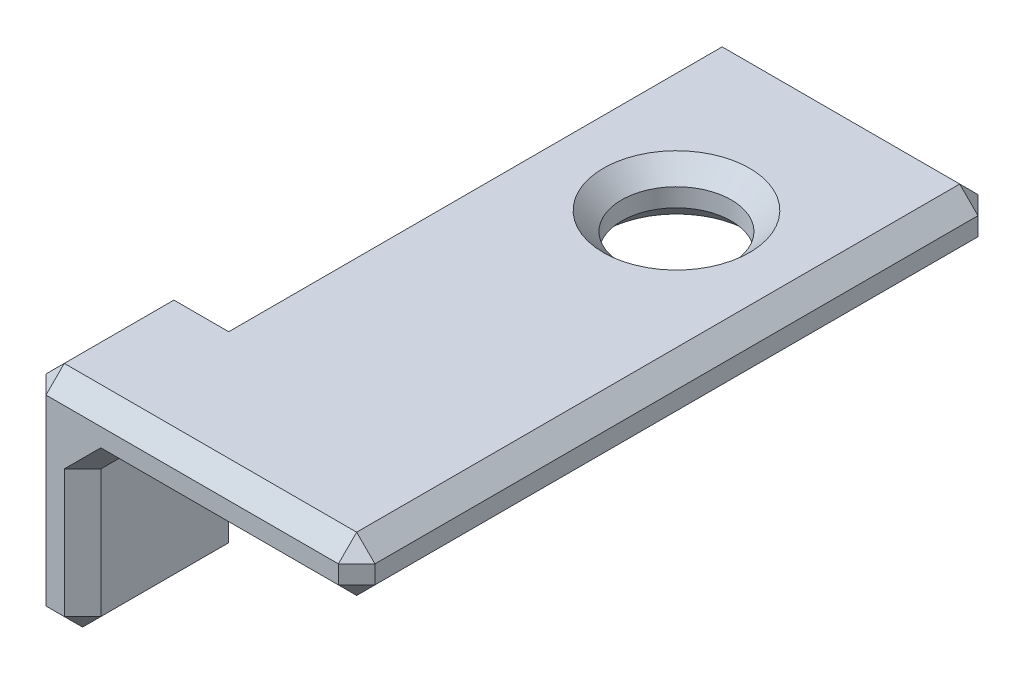
from build123d import *

# Parameters (mm, degrees)
SKETCH_1_W           = 15
SKETCH_1_H           = 20
SKETCH_1_R           = 3
EXTRUDE_1_DEPTH      = 3
SKETCH_2_W           = 15
SKETCH_2_H           = 15
EXTRUDE_2_DEPTH      = 3
EXTRUDE_3_DEPTH      = 9
EXTRUDE_3_DEPTH_BACK = 3
SKETCH_4_W           = 3
SKETCH_4_H           = 8
CHAMFER_1_SIZE       = 1


with BuildPart() as part:
    # 草图1 → 凸台-拉伸1 (new body)
    with BuildSketch(Plane(origin=(0, 0, 0), x_dir=(1, 0, 0), z_dir=(0, 1, 0))):
        with Locations((7.5, -10)):
            Rectangle(SKETCH_1_W, SKETCH_1_H)
        with Locations(Location((7.5, -10, 0), (0, 0, 270))):
            Circle(SKETCH_1_R, mode=Mode.SUBTRACT)
    extrude(amount=EXTRUDE_1_DEPTH)

    # 草图2 → 凸台-拉伸2 (add)
    with BuildSketch(Plane(origin=(0, 3, 0), x_dir=(1, 0, 0), z_dir=(0, 1, 0))):
        with Locations((7.5, -27.5)):
            Rectangle(SKETCH_2_W, SKETCH_2_H)
    extrude(amount=-EXTRUDE_2_DEPTH)

    # 草图4 → 凸台-拉伸3 (add, two sides: drawn at the far end of the back side and taken through both)
    with BuildSketch(Plane.XZ.offset(-EXTRUDE_3_DEPTH_BACK)):
        with Locations((-1.5, 31)):
            Rectangle(SKETCH_4_W, SKETCH_4_H)
    extrude(amount=EXTRUDE_3_DEPTH + EXTRUDE_3_DEPTH_BACK)

    # 倒角1
    chamfer_1_edges = [part.edges().sort_by_distance(p)[0] for p in [
        (7.5, 0, 7),
        (7.5, 3, 7),
        (15, 3, 17.5),
        (7.5, 3, 0),
        (7.5, 0, 35),
        (15, 1.5, 35),
        (6, 3, 35),
        (0, 0, 31),
        (0, -4.5, 35),
        (-1.5, 3, 27),
        (-3, -3, 27),
        (-3, 3, 31),
        (-3, -3, 35),
        (0, -9, 31),
        (-1.5, -9, 35),
        (-3, -9, 31),
        (0, 3, 13.5),
        (7.5, 0, 0),
        (15, 0, 17.5),
        (0, 1.5, 0),
        (15, 1.5, 0),
    ]]
    chamfer(chamfer_1_edges, length=CHAMFER_1_SIZE)


solid = part.part
